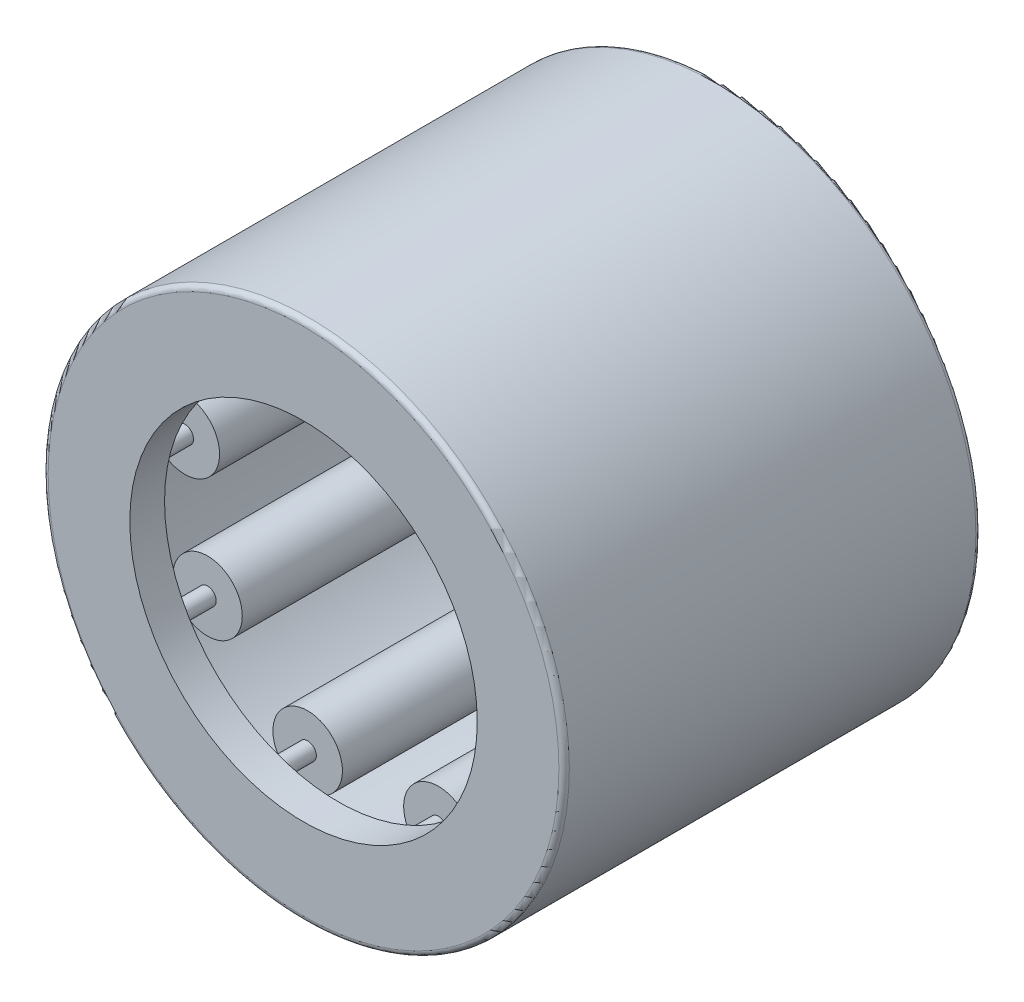
from build123d import *

# Parameters (mm, degrees)
SKETCH2_W         = 8.466666666
SKETCH2_H         = 0.79375
SKETCH3_W         = 10.583333334
SKETCH3_H         = 0.264583334
CIRPATTERN1_COUNT = 9
CIRPATTERN1_ANGLE = 320
FILLET1_R         = 0.15875


with BuildPart() as part:
    # Sketch1 → Revolve1 (revolve)
    with BuildSketch(Plane(origin=(0, 0, 0), x_dir=(0, 0, -1), z_dir=(1, 0, 0)), mode=Mode.PRIVATE) as revolve1_sk:
        Polygon((-6.35, 7.9375), (6.35, 7.9375), (6.35, 5.291666667), (5.291666667, 5.291666667), (5.291666667, 6.879166667), (-5.291666667, 6.879166667), (-5.291666667, 5.291666667), (-6.35, 5.291666667), align=None)
    revolve(revolve1_sk.sketch.rotate(Axis((0, 0, 6.35), (0, 0, -1)), 90), axis=Axis((0, 0, 6.35), (0, 0, -1)))

    # Fillet1
    fillet1_edges = [part.edges().sort_by_distance(p)[0] for p in [
        (-7.9375, 0, 6.35),
        (-7.9375, 0, -6.35),
    ]]
    fillet(fillet1_edges, radius=FILLET1_R)


with BuildPart() as body_2:
    # Sketch2 → Revolve2 (revolve)
    with BuildSketch(Plane(origin=(0, 0, 0), x_dir=(0, 0, -1), z_dir=(1, 0, 0)), mode=Mode.PRIVATE) as revolve2_sk:
        with Locations((0, 6.482291667)):
            Rectangle(SKETCH2_W, SKETCH2_H)
    revolve(revolve2_sk.sketch.rotate(Axis((0, 5.820833333, 4.233333333), (0, 0, -1)), 90), axis=Axis((0, 5.820833333, 4.233333333), (0, 0, -1)))


with BuildPart() as body_3:
    # Sketch3 → Revolve3 (revolve)
    with BuildSketch(Plane(origin=(0, 0, 0), x_dir=(0, 0, -1), z_dir=(1, 0, 0))):
        with Locations((0, 5.953125)):
            Rectangle(SKETCH3_W, SKETCH3_H)
    revolve(axis=Axis((0, 5.820833333, 5.291666667), (0, 0, -1)))


with BuildPart() as cirpattern1_1:
    # CirPattern1: pattern copy
    add(body_3.part.rotate(Axis((0, 0, -6.35), (0, 0, 1)), 1 * CIRPATTERN1_ANGLE / (CIRPATTERN1_COUNT - 1)))


with BuildPart() as cirpattern1_2:
    # CirPattern1: pattern copy
    add(body_3.part.rotate(Axis((0, 0, -6.35), (0, 0, 1)), 2 * CIRPATTERN1_ANGLE / (CIRPATTERN1_COUNT - 1)))


with BuildPart() as cirpattern1_3:
    # CirPattern1: pattern copy
    add(body_3.part.rotate(Axis((0, 0, -6.35), (0, 0, 1)), 3 * CIRPATTERN1_ANGLE / (CIRPATTERN1_COUNT - 1)))


with BuildPart() as cirpattern1_4:
    # CirPattern1: pattern copy
    add(body_3.part.rotate(Axis((0, 0, -6.35), (0, 0, 1)), 4 * CIRPATTERN1_ANGLE / (CIRPATTERN1_COUNT - 1)))


with BuildPart() as cirpattern1_5:
    # CirPattern1: pattern copy
    add(body_3.part.rotate(Axis((0, 0, -6.35), (0, 0, 1)), 5 * CIRPATTERN1_ANGLE / (CIRPATTERN1_COUNT - 1)))


with BuildPart() as cirpattern1_6:
    # CirPattern1: pattern copy
    add(body_3.part.rotate(Axis((0, 0, -6.35), (0, 0, 1)), 6 * CIRPATTERN1_ANGLE / (CIRPATTERN1_COUNT - 1)))


with BuildPart() as cirpattern1_7:
    # CirPattern1: pattern copy
    add(body_3.part.rotate(Axis((0, 0, -6.35), (0, 0, 1)), 7 * CIRPATTERN1_ANGLE / (CIRPATTERN1_COUNT - 1)))


with BuildPart() as cirpattern1_8:
    # CirPattern1: pattern copy
    add(body_3.part.rotate(Axis((0, 0, -6.35), (0, 0, 1)), 8 * CIRPATTERN1_ANGLE / (CIRPATTERN1_COUNT - 1)))


with BuildPart() as cirpattern1_9:
    # CirPattern1: pattern copy
    add(body_2.part.rotate(Axis((0, 0, -6.35), (0, 0, 1)), 1 * CIRPATTERN1_ANGLE / (CIRPATTERN1_COUNT - 1)))


with BuildPart() as cirpattern1_10:
    # CirPattern1: pattern copy
    add(body_2.part.rotate(Axis((0, 0, -6.35), (0, 0, 1)), 2 * CIRPATTERN1_ANGLE / (CIRPATTERN1_COUNT - 1)))


with BuildPart() as cirpattern1_11:
    # CirPattern1: pattern copy
    add(body_2.part.rotate(Axis((0, 0, -6.35), (0, 0, 1)), 3 * CIRPATTERN1_ANGLE / (CIRPATTERN1_COUNT - 1)))


with BuildPart() as cirpattern1_12:
    # CirPattern1: pattern copy
    add(body_2.part.rotate(Axis((0, 0, -6.35), (0, 0, 1)), 4 * CIRPATTERN1_ANGLE / (CIRPATTERN1_COUNT - 1)))


with BuildPart() as cirpattern1_13:
    # CirPattern1: pattern copy
    add(body_2.part.rotate(Axis((0, 0, -6.35), (0, 0, 1)), 5 * CIRPATTERN1_ANGLE / (CIRPATTERN1_COUNT - 1)))


with BuildPart() as cirpattern1_14:
    # CirPattern1: pattern copy
    add(body_2.part.rotate(Axis((0, 0, -6.35), (0, 0, 1)), 6 * CIRPATTERN1_ANGLE / (CIRPATTERN1_COUNT - 1)))


with BuildPart() as cirpattern1_15:
    # CirPattern1: pattern copy
    add(body_2.part.rotate(Axis((0, 0, -6.35), (0, 0, 1)), 7 * CIRPATTERN1_ANGLE / (CIRPATTERN1_COUNT - 1)))


with BuildPart() as cirpattern1_16:
    # CirPattern1: pattern copy
    add(body_2.part.rotate(Axis((0, 0, -6.35), (0, 0, 1)), 8 * CIRPATTERN1_ANGLE / (CIRPATTERN1_COUNT - 1)))


solid = Compound([part.part, body_2.part, body_3.part, cirpattern1_1.part, cirpattern1_2.part, cirpattern1_3.part, cirpattern1_4.part, cirpattern1_5.part, cirpattern1_6.part, cirpattern1_7.part, cirpattern1_8.part, cirpattern1_9.part, cirpattern1_10.part, cirpattern1_11.part, cirpattern1_12.part, cirpattern1_13.part, cirpattern1_14.part, cirpattern1_15.part, cirpattern1_16.part])
